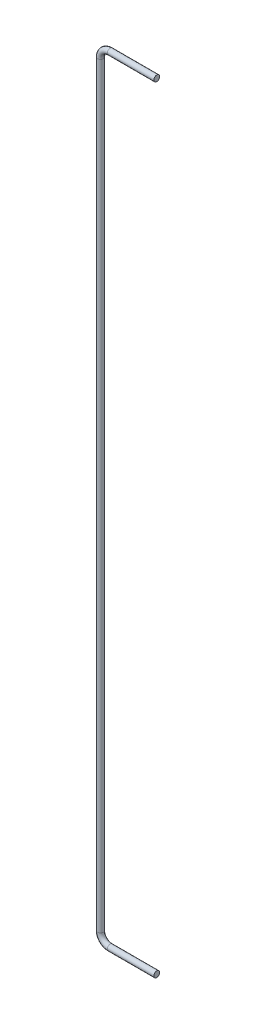
from build123d import *

# Parameters (mm, degrees)
ESQUISSE2_R = 1.5


with BuildPart() as part:
    # Balayage1: sweep along a path in Esquisse1
    with BuildLine(Plane.XY) as balayage1_path:
        Line((0, 0), (-24, 0))
        ThreePointArc((-24, 0), (-27.535533906, 1.464466094), (-29, 5))
        Line((-29, 5), (-29, 395))
        ThreePointArc((-29, 395), (-27.535533906, 398.535533906), (-24, 400))
        Line((-24, 400), (0, 400))
    # Esquisse2 → Balayage1 (sweep)
    with BuildSketch(Plane(origin=(0, 0, 0), x_dir=(0, 0, -1), z_dir=(1, 0, 0))):
        Circle(ESQUISSE2_R)
    sweep(path=balayage1_path.line)


solid = part.part
